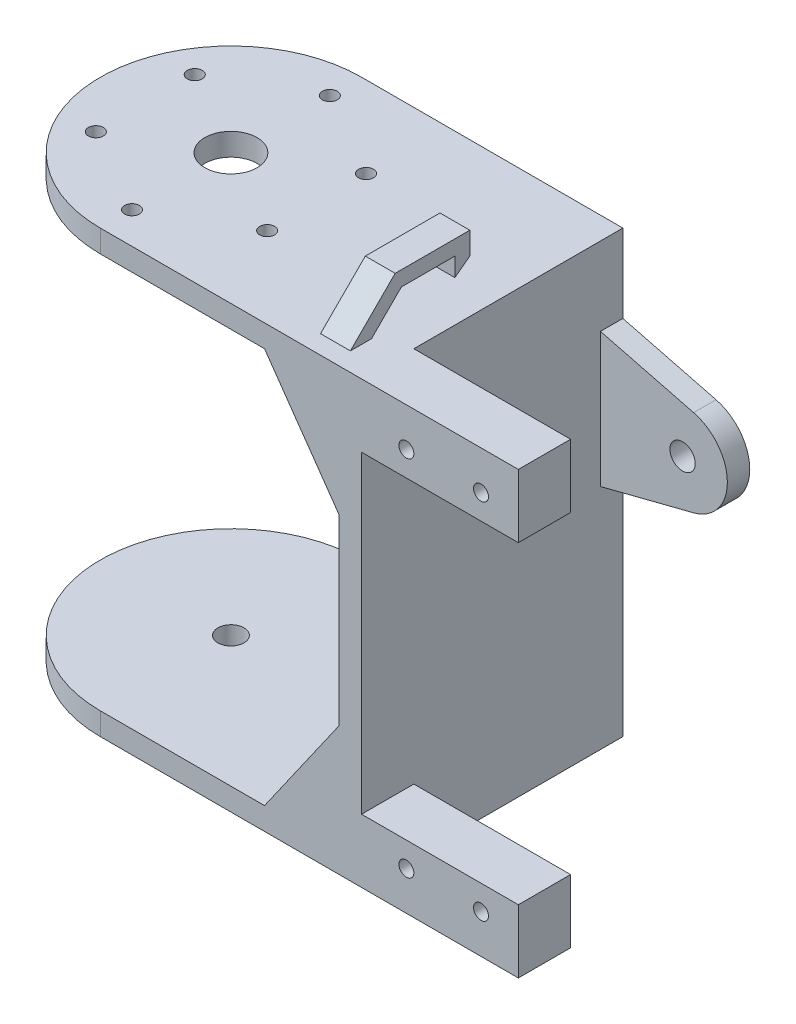
from build123d import *
from OCP.BRepFilletAPI import BRepFilletAPI_MakeChamfer

# Parameters (mm, degrees)
ESBO_O1_R                  = 1
RESSALTO_EXTRUS_O1_DEPTH   = 17.5
ESBO_O2_R                  = 3.5
ESBO_O2_R_2                = 1
CORTE_EXTRUS_O1_DEPTH      = 15
CORTE_EXTRUS_O2_DEPTH      = 76.269515742
CORTE_EXTRUS_O2_DEPTH_BACK = 76.269515742
ESBO_O4_W                  = 21
ESBO_O4_H                  = 28
ESBO_O5_R                  = 1.7
RESSALTO_EXTRUS_O2_DEPTH   = 3
CHANFRO1_SIZE              = 10
CHANFRO1_SIZE2             = 14.281480067
ESBO_O7_R                  = 1.75
CORTE_EXTRUS_O3_DEPTH      = 10
CORTE_EXTRUS_O4_DEPTH      = 82.217301113
RESSALTO_EXTRUS_O3_START   = -4
RESSALTO_EXTRUS_O3_DEPTH   = 4
CORTE_EXTRUS_O5_REACH      = 85.105


with BuildPart() as part:
    # Esboço1 → Ressalto-extrusão1 (new, symmetric)
    with BuildSketch(Plane.XY):
        Polygon((0, -29.5), (-53, -29.5), (-53, -26.5), (-3, -26.5), (-3, 26.5), (-53, 26.5), (-53, 29.5), (1, 29.5), (21, 29.5), (21, 21), (0, 21), (0, -21), (21, -21), (21, -29.5), align=None)
        with Locations((16, 24.315)):
            Circle(ESBO_O1_R, mode=Mode.SUBTRACT)
        with Locations((6, 24.315)):
            Circle(ESBO_O1_R, mode=Mode.SUBTRACT)
        with Locations(Location((16, -24.315, 0), (0, 0, 180))):
            Circle(ESBO_O1_R, mode=Mode.SUBTRACT)
        with Locations(Location((6, -24.315, 0), (0, 0, 180))):
            Circle(ESBO_O1_R, mode=Mode.SUBTRACT)
    extrude(amount=RESSALTO_EXTRUS_O1_DEPTH, both=True)

    # Esboço2 → Corte-extrusão1 (cut)
    with BuildSketch(Plane(origin=(0, 29.5, 0), x_dir=(1, 0, 0), z_dir=(0, 1, 0))):
        with Locations(Location((-35, 0, 0), (0, 0, 270))):
            Circle(ESBO_O2_R)
        with Locations(Location((-35, 13.25, 0), (0, 0, 270))):
            Circle(ESBO_O2_R_2)
        with Locations(Location((-23.5251634, 6.625, 0), (0, 0, 270))):
            Circle(ESBO_O2_R_2)
        with Locations(Location((-23.5251634, -6.625, 0), (0, 0, 270))):
            Circle(ESBO_O2_R_2)
        with Locations(Location((-35, -13.25, 0), (0, 0, 270))):
            Circle(ESBO_O2_R_2)
        with Locations(Location((-46.4748366, -6.625, 0), (0, 0, 270))):
            Circle(ESBO_O2_R_2)
        with Locations(Location((-46.4748366, 6.625, 0), (0, 0, 270))):
            Circle(ESBO_O2_R_2)
        with BuildLine():
            Line((-35, 17.5), (-53, 17.5))
            Line((-53, 17.5), (-53, -17.5))
            Line((-53, -17.5), (-35, -17.5))
            ThreePointArc((-35, -17.5), (-52.5, 0), (-35, 17.5))
        make_face()
    extrude(amount=-CORTE_EXTRUS_O1_DEPTH, mode=Mode.SUBTRACT)

    # Esboço4 → Corte-extrusão2 (cut, two sides: drawn at the far end of the back side and taken through both)
    with BuildSketch(Plane(origin=(0, -21, 0), x_dir=(1, 0, 0), z_dir=(0, 1, 0)).offset(-CORTE_EXTRUS_O2_DEPTH_BACK)):
        with Locations((10.5, 3.5)):
            Rectangle(ESBO_O4_W, ESBO_O4_H)
    extrude(amount=CORTE_EXTRUS_O2_DEPTH + CORTE_EXTRUS_O2_DEPTH_BACK, mode=Mode.SUBTRACT)

    # Esboço5 → Ressalto-extrusão2 (add)
    with BuildSketch(Plane(origin=(0, 0, -17.5), x_dir=(-1, 0, 0), z_dir=(0, 0, -1))):
        with BuildLine():
            Line((-12.483867976, 15.828616416), (0, 19.015))
            Line((0, 19.015), (0, 1.015))
            Line((0, 1.015), (-12.483867976, 4.201383584))
            ThreePointArc((-12.483867976, 4.201383584), (-17, 10.015), (-12.483867976, 15.828616416))
        make_face()
        with Locations((-11, 10.015)):
            Circle(ESBO_O5_R, mode=Mode.SUBTRACT)
    extrude(amount=-RESSALTO_EXTRUS_O2_DEPTH)

    # Chanfro1: one chamfer whose edges measure the first distance from different faces: ONE call of the kernel's chamfer builder (chamfer() names one face for all edges)
    chanfro1_edges_1 = [part.edges().sort_by_distance(p)[0] for p in [
        (-3, 26.5, 0),
    ]]
    chanfro1_side_1 = [part.faces().sort_by_distance(p)[0] for p in [
        (-25.706176073, 26.5, 0),
    ]]
    chanfro1_edges_2 = [part.edges().sort_by_distance(p)[0] for p in [
        (-3, -26.5, 0),
    ]]
    chanfro1_side_2 = [part.faces().sort_by_distance(p)[0] for p in [
        (-28, -26.5, 0),
    ]]
    chanfro1 = BRepFilletAPI_MakeChamfer(part.part.solid().wrapped)
    for e in chanfro1_edges_1:
        chanfro1.Add(CHANFRO1_SIZE, CHANFRO1_SIZE2, e.wrapped, chanfro1_side_1[0].wrapped)  # the first distance lies on this face
    for e in chanfro1_edges_2:
        chanfro1.Add(CHANFRO1_SIZE, CHANFRO1_SIZE2, e.wrapped, chanfro1_side_2[0].wrapped)  # the first distance lies on this face
    add(Compound.cast(chanfro1.Shape()), mode=Mode.REPLACE)

    # Esboço7 → Corte-extrusão3 (cut)
    with BuildSketch(Plane(origin=(0, -26.5, 0), x_dir=(1, 0, 0), z_dir=(0, 1, 0))):
        with Locations(Location((-35, 0, 0), (0, 0, 270))):
            Circle(ESBO_O7_R)
    extrude(amount=-CORTE_EXTRUS_O3_DEPTH, mode=Mode.SUBTRACT)

    # Esboço2<2> → Corte-extrusão4 (cut, through all)
    with BuildSketch(Plane(origin=(0, 29.5, 0), x_dir=(1, 0, 0), z_dir=(0, 1, 0))):
        with BuildLine():
            ThreePointArc((-35, -17.5), (-52.5, 0), (-35, 17.5))
            Line((-35, 17.5), (-53, 17.5))
            Line((-53, 17.5), (-53, -17.5))
            Line((-53, -17.5), (-35, -17.5))
        make_face()
    extrude(amount=-CORTE_EXTRUS_O4_DEPTH, mode=Mode.SUBTRACT)

    # Esboço8 → Ressalto-extrusão3 (add)
    with BuildSketch(Plane(origin=(0, 0, 0), x_dir=(0, 0, -1), z_dir=(1, 0, 0)).offset(RESSALTO_EXTRUS_O3_START)):
        Polygon((-15, 29.5), (-9, 35.5), (1, 35.5), (1, 32.5), (-1, 31), (-1, 33.5), (-8.171572875, 33.5), (-12.171572875, 29.5), align=None)
    extrude(amount=-RESSALTO_EXTRUS_O3_DEPTH)

    # Corte-extrusão5: up to this face of the body (flat: up to its plane)
    corte_extrus_o5_end = Plane(part.part.faces().sort_by_distance((-30.897636079, 26.5, 0))[0])
    # Esboço9 → Corte-extrusão5 (cut, up to the picked face)
    with BuildSketch(Plane(origin=(0, -26.5, 0), x_dir=(1, 0, 0), z_dir=(0, 1, 0)), mode=Mode.PRIVATE) as corte_extrus_o5_sk1:
        with BuildLine():
            Line((-18.575932294, 17.5), (-18.575932294, -17.5))
            ThreePointArc((-18.575932294, -17.5), (-11, 0), (-18.575932294, 17.5))
        make_face()
    corte_extrus_o5_tool1 = split(extrude(corte_extrus_o5_sk1.sketch, amount=CORTE_EXTRUS_O5_REACH, mode=Mode.PRIVATE), bisect_by=corte_extrus_o5_end, keep=Keep.BOTH, mode=Mode.PRIVATE)
    add(corte_extrus_o5_tool1.solids().sort_by(Axis((-15.500415, -26.5, 0), (0, 1, 0)))[0], mode=Mode.SUBTRACT)


solid = part.part
